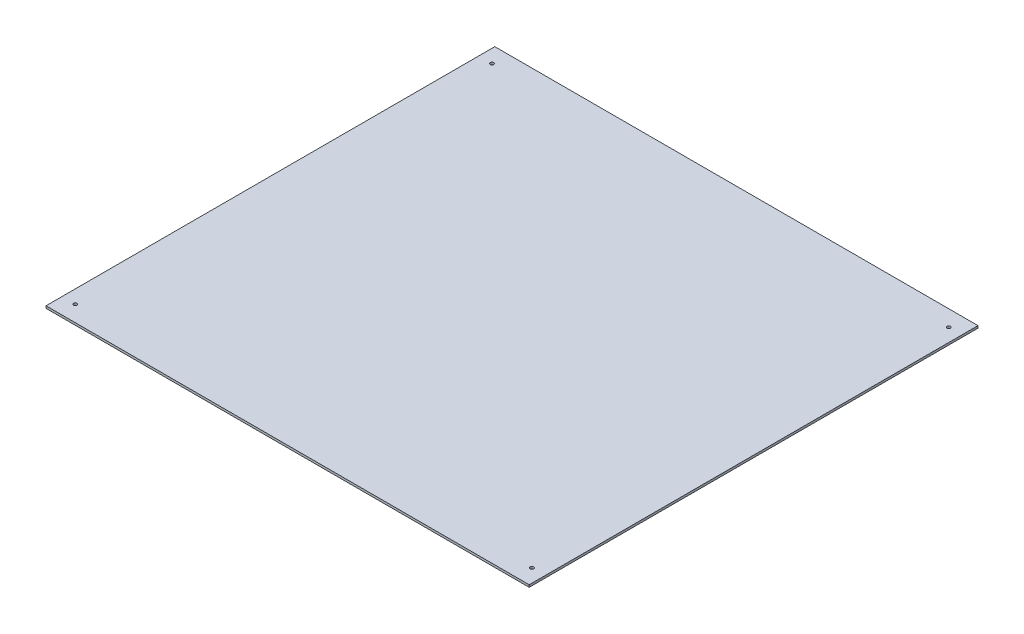
from build123d import *

# Parameters (mm, degrees)
CROQUIS1_W              = 430.5
CROQUIS1_H              = 400
SALIENTE_EXTRUIR1_DEPTH = 2
CROQUIS2_R              = 1.55
CORTAR_EXTRUIR1_DEPTH   = 2
CROQUIS3_W              = 430.5
CROQUIS3_H              = 400
CROQUIS3_W_2            = 429
CROQUIS3_H_2            = 398.5
CORTAR_EXTRUIR2_DEPTH   = 2


with BuildPart() as part:
    # Croquis1 → Saliente-Extruir1 (new body)
    with BuildSketch(Plane(origin=(0, 0, 0), x_dir=(1, 0, 0), z_dir=(0, 1, 0))):
        with Locations((215.25, 200)):
            Rectangle(CROQUIS1_W, CROQUIS1_H)
    extrude(amount=SALIENTE_EXTRUIR1_DEPTH)

    # Croquis2 → Cortar-Extruir1 (cut)
    with BuildSketch(Plane(origin=(0, 2, 0), x_dir=(1, 0, 0), z_dir=(0, 1, 0))):
        with Locations(Location((12.5, 385, 0), (0, 0, 270))):
            Circle(CROQUIS2_R)
        with Locations(Location((418, 385, 0), (0, 0, 90))):
            Circle(CROQUIS2_R)
        with Locations(Location((418, 15, 0), (0, 0, 270))):
            Circle(CROQUIS2_R)
        with Locations(Location((12.5, 15, 0), (0, 0, 90))):
            Circle(CROQUIS2_R)
    extrude(amount=-CORTAR_EXTRUIR1_DEPTH, mode=Mode.SUBTRACT)

    # Croquis3 → Cortar-Extruir2 (cut)
    with BuildSketch(Plane(origin=(0, 2, 0), x_dir=(1, 0, 0), z_dir=(0, 1, 0))):
        with Locations((215.25, 200)):
            Rectangle(CROQUIS3_W, CROQUIS3_H)
        with Locations((215.25, 200)):
            Rectangle(CROQUIS3_W_2, CROQUIS3_H_2, mode=Mode.SUBTRACT)
    extrude(amount=-CORTAR_EXTRUIR2_DEPTH, mode=Mode.SUBTRACT)


solid = part.part
